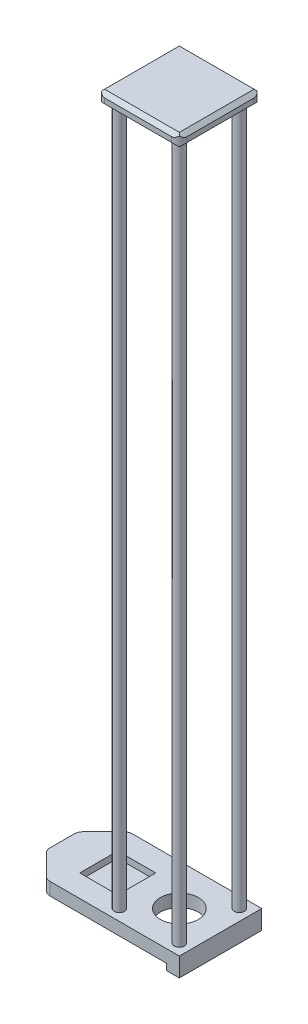
from build123d import *

# Parameters (mm, degrees)
SKETCH1_W            = 130
SKETCH1_H            = 130
BOSS_EXTRUDE2_DEPTH  = 20
SKETCH2_R            = 40
CUT_EXTRUDE1_DEPTH   = 95.074438611
SKETCH3_R            = 40
SKETCH3_R_2          = 30
BOSS_EXTRUDE3_DEPTH  = 20
SKETCH4_W            = 125.450553561
SKETCH4_H            = 31.465087356
CUT_EXTRUDE2_DEPTH   = 151.748134317
BOSS_EXTRUDE4_START  = -20
SKETCH5_R            = 40
SKETCH5_R_2          = 30
BOSS_EXTRUDE4_DEPTH  = 20
SKETCH6_R            = 8
BOSS_EXTRUDE5_DEPTH  = 1100
SKETCH7_W            = 130
SKETCH7_H            = 130
BOSS_EXTRUDE6_DEPTH  = 20
SKETCH8_W            = 20
SKETCH8_H            = 130
BOSS_EXTRUDE7_DEPTH  = 10
SKETCH9_W            = 130
SKETCH9_H            = 20
BOSS_EXTRUDE8_DEPTH  = 120
SKETCH10_R           = 5
BOSS_EXTRUDE9_DEPTH  = 10
SKETCH11_R           = 5
CUT_EXTRUDE3_DEPTH   = 1157.741111917
SKETCH12_W           = 60
SKETCH12_H           = 60
CUT_EXTRUDE4_DEPTH   = 10
CHAMFER1_SIZE        = 40
FILLET1_R            = 15
BOSS_EXTRUDE10_DEPTH = 10
CHAMFER2_SIZE        = 6
FILLET2_R            = 12


with BuildPart() as part:
    # Sketch1 → Boss-Extrude2 (new body)
    with BuildSketch(Plane(origin=(0, 0, 0), x_dir=(1, 0, 0), z_dir=(0, 1, 0))):
        Rectangle(SKETCH1_W, SKETCH1_H)
    extrude(amount=BOSS_EXTRUDE2_DEPTH)

    # Sketch2 → Cut-Extrude1 (cut, through all)
    with BuildSketch(Plane(origin=(0, 20, 0), x_dir=(1, 0, 0), z_dir=(0, 1, 0))):
        with Locations(Location((0, 0, 0), (0, 0, 270))):
            Circle(SKETCH2_R)
    extrude(amount=-CUT_EXTRUDE1_DEPTH, mode=Mode.SUBTRACT)

    # Sketch5 → Boss-Extrude4 (add)
    with BuildSketch(Plane.XZ.offset(BOSS_EXTRUDE4_START)):
        Circle(SKETCH5_R)
        with Locations(Location((0, 0, 0), (0, 0, 270))):
            Circle(SKETCH5_R_2, mode=Mode.SUBTRACT)
    extrude(amount=BOSS_EXTRUDE4_DEPTH)

    # Sketch6 → Boss-Extrude5 (add)
    with BuildSketch(Plane(origin=(0, 20, 0), x_dir=(1, 0, 0), z_dir=(0, 1, 0))):
        with Locations(Location((-47.32233047, 47.32233047, 0), (0, 0, 90))):
            Circle(SKETCH6_R)
        with Locations(Location((47.32233047, 47.32233047, 0), (0, 0, 90))):
            Circle(SKETCH6_R)
        with Locations(Location((47.32233047, -47.32233047, 0), (0, 0, 90))):
            Circle(SKETCH6_R)
        with Locations(Location((-47.32233047, -47.32233047, 0), (0, 0, 90))):
            Circle(SKETCH6_R)
    extrude(amount=BOSS_EXTRUDE5_DEPTH)

    # Sketch7 → Boss-Extrude6 (add)
    with BuildSketch(Plane(origin=(0, 1120, 0), x_dir=(1, 0, 0), z_dir=(0, 1, 0))):
        Rectangle(SKETCH7_W, SKETCH7_H)
    extrude(amount=BOSS_EXTRUDE6_DEPTH)

    # Sketch8 → Boss-Extrude7 (add)
    with BuildSketch(Plane.XZ):
        with Locations((55, 0)):
            Rectangle(SKETCH8_W, SKETCH8_H)
    extrude(amount=BOSS_EXTRUDE7_DEPTH)

    # Sketch9 → Boss-Extrude8 (add)
    with BuildSketch(Plane.ZY.offset(65)):
        with Locations((0, 10)):
            Rectangle(SKETCH9_W, SKETCH9_H)
    extrude(amount=BOSS_EXTRUDE8_DEPTH)

    # Sketch10 → Boss-Extrude9 (add)
    with BuildSketch(Plane.XZ):
        with Locations(Location((-48.62, 0, 0), (0, 0, 270))):
            Circle(SKETCH10_R)
    extrude(amount=BOSS_EXTRUDE9_DEPTH)

    # Sketch11 → Cut-Extrude3 (cut, through all)
    with BuildSketch(Plane.XZ):
        with Locations(Location((-97.24, 0, 0), (0, 0, 270))):
            Circle(SKETCH11_R)
    extrude(amount=-CUT_EXTRUDE3_DEPTH, mode=Mode.SUBTRACT)

    # Sketch12 → Cut-Extrude4 (cut)
    with BuildSketch(Plane(origin=(0, 20, 0), x_dir=(1, 0, 0), z_dir=(0, 1, 0))):
        with Locations((-97.24, 0)):
            Rectangle(SKETCH12_W, SKETCH12_H)
    extrude(amount=-CUT_EXTRUDE4_DEPTH, mode=Mode.SUBTRACT)

    # Chamfer1
    chamfer1_edges = [part.edges().sort_by_distance(p)[0] for p in [
        (-185, 10, -65),
        (-185, 10, 65),
    ]]
    chamfer(chamfer1_edges, length=CHAMFER1_SIZE)

    # Fillet1
    fillet1_edges = [part.edges().sort_by_distance(p)[0] for p in [
        (-185, 10, 25),
        (-185, 10, -25),
        (-145, 10, -65),
        (-145, 10, 65),
    ]]
    fillet(fillet1_edges, radius=FILLET1_R)

    # Sketch13 → Boss-Extrude10 (add)
    with BuildSketch(Plane.XZ):
        with BuildLine():
            Line((-157.902531243, -15.727314256), (-157.902531243, 15.727314256))
            ThreePointArc((-157.902531243, 15.727314256), (-142.902531243, 30.727314256), (-127.902531243, 15.727314256))
            Line((-127.902531243, 15.727314256), (-127.902531243, -15.727314256))
            ThreePointArc((-127.902531243, -15.727314256), (-142.902531243, -30.727314256), (-157.902531243, -15.727314256))
        make_face()
    extrude(amount=BOSS_EXTRUDE10_DEPTH)

    # Chamfer2
    chamfer2_edges = [part.edges().sort_by_distance(p)[0] for p in [
        (-65, 1120, 0),
        (0, 1120, 65),
        (65, 1120, 0),
        (0, 1120, -65),
        (-65, 1140, 0),
        (0, 1140, 65),
        (65, 1140, 0),
        (0, 1140, -65),
    ]]
    chamfer(chamfer2_edges, length=CHAMFER2_SIZE)

    # Fillet2
    fillet2_edges = [part.edges().sort_by_distance(p)[0] for p in [
        (-65, 1130, -65),
        (65, 1130, -65),
        (65, 1130, 65),
        (-65, 1130, 65),
    ]]
    fillet(fillet2_edges, radius=FILLET2_R)


with BuildPart() as body_2:
    # Sketch3 → Boss-Extrude3 (new body)
    with BuildSketch(Plane(origin=(0, 20, 0), x_dir=(1, 0, 0), z_dir=(0, 1, 0))):
        with Locations(Location((0, 0, 0), (0, 0, 270))):
            Circle(SKETCH3_R)
        with Locations(Location((0, 0, 0), (0, 0, 270))):
            Circle(SKETCH3_R_2, mode=Mode.SUBTRACT)
    extrude(amount=BOSS_EXTRUDE3_DEPTH)

    # Sketch4 → Cut-Extrude2 (cut, through all)
    with BuildSketch(Plane.XY.offset(65)):
        with Locations((-2.274723219, 35.732543678)):
            Rectangle(SKETCH4_W, SKETCH4_H)
    extrude(amount=-CUT_EXTRUDE2_DEPTH, mode=Mode.SUBTRACT)


solid = part.part
